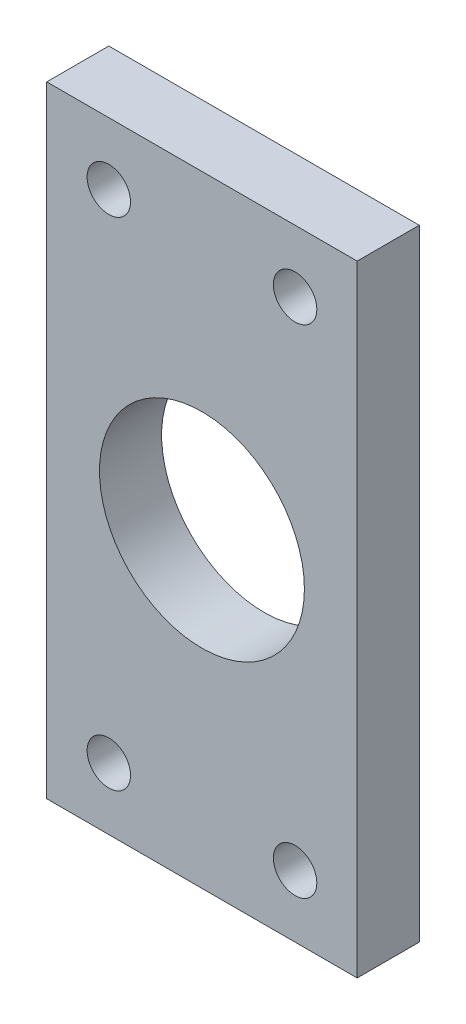
from build123d import *

# Parameters (mm, degrees)
SKETCH_1_W      = 25
SKETCH_1_H      = 50
SKETCH_1_R      = 8.25
SKETCH_1_R_2    = 1.75
EXTRUDE_1_DEPTH = 5


with BuildPart() as part:
    # ｽｹｯﾁ1 → ﾎﾞｽ - 押し出し1 (new body)
    with BuildSketch(Plane.XY):
        Rectangle(SKETCH_1_W, SKETCH_1_H)
        Circle(SKETCH_1_R, mode=Mode.SUBTRACT)
        with Locations((-7.5, 20)):
            Circle(SKETCH_1_R_2, mode=Mode.SUBTRACT)
        with Locations((7.5, 20)):
            Circle(SKETCH_1_R_2, mode=Mode.SUBTRACT)
        with Locations((-7.5, -20)):
            Circle(SKETCH_1_R_2, mode=Mode.SUBTRACT)
        with Locations((7.5, -20)):
            Circle(SKETCH_1_R_2, mode=Mode.SUBTRACT)
    extrude(amount=EXTRUDE_1_DEPTH)


solid = part.part
